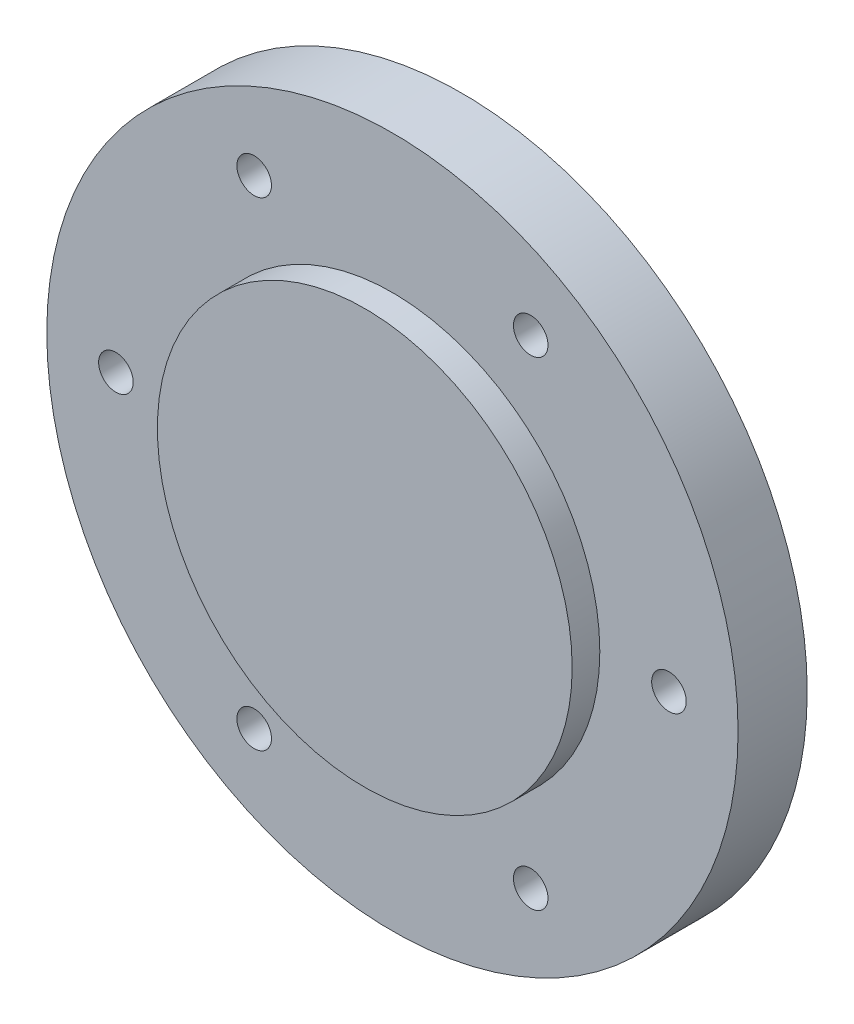
from build123d import *

# Parameters (mm, degrees)
SK_DISC_R                 = 25
OUTPUT_DISC_DEPTH         = 5
SK_PILOT_R                = 15
PILOT_BOSS_DEPTH          = 2
SK_OUTHOLE_R              = 1.25
OUTPUT_TAPPED_HOLE_DEPTH  = 5
OUTPUT_HOLE_PATTERN_COUNT = 6


with BuildPart() as part:
    # SK_Disc → Output_Disc (new body)
    with BuildSketch(Plane.XY):
        Circle(SK_DISC_R)
    extrude(amount=OUTPUT_DISC_DEPTH)

    # SK_Pilot → Pilot_Boss (add)
    with BuildSketch(Plane.XY.offset(5)):
        Circle(SK_PILOT_R)
    extrude(amount=PILOT_BOSS_DEPTH)

    # SK_OutHole → Output_Tapped_Hole (cut)
    with BuildSketch(Plane.XY.offset(5)):
        with Locations((20, 0)):
            Circle(SK_OUTHOLE_R)
    output_tapped_hole = extrude(amount=-OUTPUT_TAPPED_HOLE_DEPTH, mode=Mode.SUBTRACT)

    # Output_Hole_Pattern: Output_Tapped_Hole ×6 about axis
    output_hole_pattern_axis = Axis((0, 0, -0.35), (0, 0, 1))
    for i in range(1, OUTPUT_HOLE_PATTERN_COUNT):
        add(output_tapped_hole.rotate(output_hole_pattern_axis, i * 360 / OUTPUT_HOLE_PATTERN_COUNT), mode=Mode.SUBTRACT)


solid = part.part
